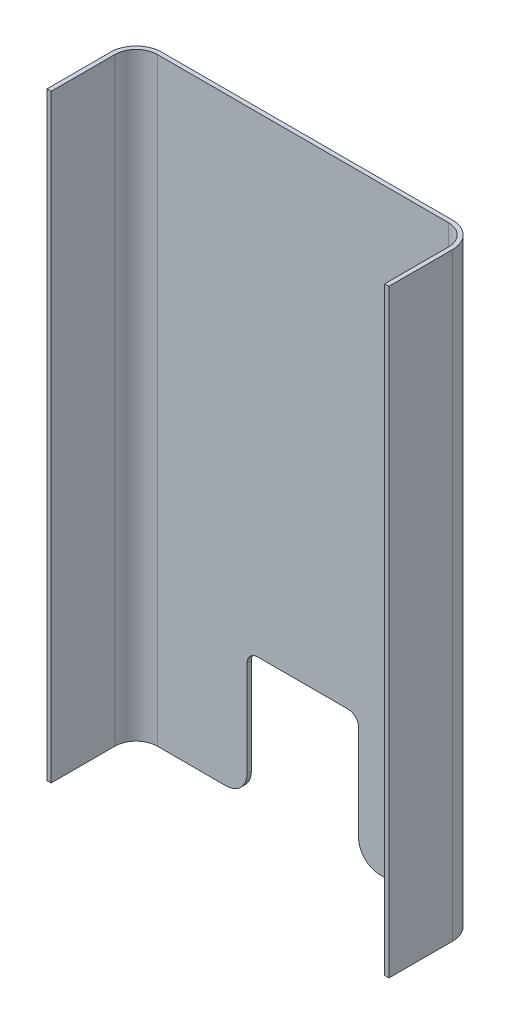
from build123d import *

# Parameters (mm, degrees)
EXTRUDE_THIN1_DEPTH     = 564
CUT_EXTRUDE1_DEPTH      = 593.514134852
CUT_EXTRUDE1_DEPTH_BACK = 593.514134852
SKETCH2_W               = 105
SKETCH2_H               = 260.267111285
FILLET2_R               = 10
FILLET3_R               = 20


with BuildPart() as part:
    # Sketch1 → Extrude-Thin1 (new body)
    with BuildSketch(Plane(origin=(0, 0, 0), x_dir=(1, 0, 0), z_dir=(0, 1, 0))):
        with BuildLine():
            Line((-157, -80), (-157, -20))
            ThreePointArc((-157, -20), (-151.142135624, -5.857864376), (-137, 0))
            Line((-137, 0), (137, 0))
            ThreePointArc((137, 0), (151.142135624, -5.857864376), (157, -20))
            Line((157, -20), (157, -80))
            Line((157, -80), (161, -80))
            Line((161, -80), (161, -20))
            ThreePointArc((161, -20), (153.970562748, -3.029437252), (137, 4))
            Line((137, 4), (-137, 4))
            ThreePointArc((-137, 4), (-153.970562748, -3.029437252), (-161, -20))
            Line((-161, -20), (-161, -80))
            Line((-161, -80), (-157, -80))
        make_face()
    extrude(amount=EXTRUDE_THIN1_DEPTH)

    # Sketch2 → Cut-Extrude1 (cut, two sides: drawn at the far end of the back side and taken through both)
    with BuildSketch(Plane(origin=(0, 0, -4), x_dir=(-1, 0, 0), z_dir=(0, 0, -1)).offset(-CUT_EXTRUDE1_DEPTH_BACK)):
        with Locations((0, -10.133555642)):
            Rectangle(SKETCH2_W, SKETCH2_H)
    extrude(amount=CUT_EXTRUDE1_DEPTH + CUT_EXTRUDE1_DEPTH_BACK, mode=Mode.SUBTRACT)

    # Fillet2
    fillet2_edges = [part.edges().sort_by_distance(p)[0] for p in [
        (52.5, 120, -2),
        (-52.5, 120, -2),
    ]]
    fillet(fillet2_edges, radius=FILLET2_R)

    # Fillet3
    fillet3_edges = [part.edges().sort_by_distance(p)[0] for p in [
        (-52.5, 0, -2),
        (52.5, 0, -2),
    ]]
    fillet(fillet3_edges, radius=FILLET3_R)


solid = part.part
